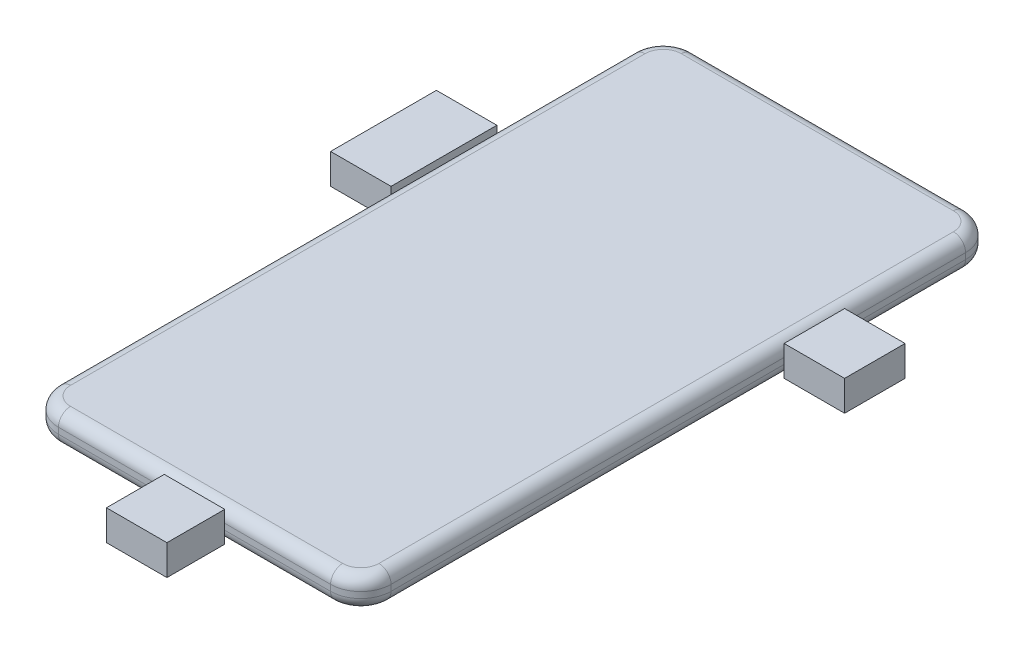
from build123d import *

# Parameters (mm, degrees)
SKETCH1_W           = 69.85
SKETCH1_H           = 133.35
BOSS_EXTRUDE1_DEPTH = 6.35
FILLET2_R           = 6.35
FILLET3_R           = 2.54
SKETCH2_W           = 12.7
SKETCH2_H           = 12.7
BUTTONS_DEPTH       = 6.35
SKETCH2_H_2         = 22.225
BUTTONS_2_DEPTH     = 6.35
SKETCH3_W           = 44.45
SKETCH3_H           = 19.05
CAMERA_DEPTH        = 6.35
SKETCH4_W           = 12.7
SKETCH4_H           = 12.141639095
USB_DEPTH           = 6.35


with BuildPart() as part:
    # Sketch1 → Boss-Extrude1 (new body)
    with BuildSketch(Plane(origin=(0, 0, 0), x_dir=(1, 0, 0), z_dir=(0, 1, 0))):
        with Locations((34.925, 66.675)):
            Rectangle(SKETCH1_W, SKETCH1_H)
    extrude(amount=BOSS_EXTRUDE1_DEPTH)

    # Fillet2
    fillet2_edges = [part.edges().sort_by_distance(p)[0] for p in [
        (0, 3.175, -133.35),
        (69.85, 3.175, -133.35),
        (69.85, 3.175, 0),
        (0, 3.175, 0),
    ]]
    fillet(fillet2_edges, radius=FILLET2_R)

    # Fillet3
    fillet3_edges = [part.edges().sort_by_distance(p)[0] for p in [
        (0, 0, -66.675),
        (0, 6.35, -66.675),
        (34.925, 0, -133.35),
        (69.85, 0, -66.675),
        (34.925, 0, 0),
        (67.990128061, 0, -1.859871939),
        (1.859871939, 0, -1.859871939),
        (67.990128061, 0, -131.490128061),
        (1.859871939, 0, -131.490128061),
        (34.925, 6.35, -133.35),
        (34.925, 6.35, 0),
        (69.85, 6.35, -66.675),
        (67.990128061, 6.35, -1.859871939),
        (1.859871939, 6.35, -1.859871939),
        (67.990128061, 6.35, -131.490128061),
        (1.859871939, 6.35, -131.490128061),
    ]]
    fillet(fillet3_edges, radius=FILLET3_R)


with BuildPart() as body_2:
    # Sketch2 → buttons (new body)
    with BuildSketch(Plane(origin=(0, 0, 0), x_dir=(1, 0, 0), z_dir=(0, 1, 0))):
        with Locations((76.2, 95.25)):
            Rectangle(SKETCH2_W, SKETCH2_H)
    extrude(amount=BUTTONS_DEPTH)


with BuildPart() as body_3:
    # Sketch2 → buttons 2 (new body)
    with BuildSketch(Plane(origin=(0, 0, 0), x_dir=(1, 0, 0), z_dir=(0, 1, 0))):
        with Locations((-6.35, 87.3125)):
            Rectangle(SKETCH2_W, SKETCH2_H_2)
    extrude(amount=BUTTONS_2_DEPTH)


with BuildPart() as body_4:
    # Sketch3 → camera (new body)
    with BuildSketch(Plane.XZ):
        with Locations((34.925, -117.475)):
            Rectangle(SKETCH3_W, SKETCH3_H)
    extrude(amount=CAMERA_DEPTH)


with BuildPart() as body_5:
    # Sketch4 → USB (new body)
    with BuildSketch(Plane(origin=(0, 0, 0), x_dir=(1, 0, 0), z_dir=(0, 1, 0))):
        with Locations((34.925, -6.070819548)):
            Rectangle(SKETCH4_W, SKETCH4_H)
    extrude(amount=USB_DEPTH)


solid = Compound([part.part, body_2.part, body_3.part, body_4.part, body_5.part])
